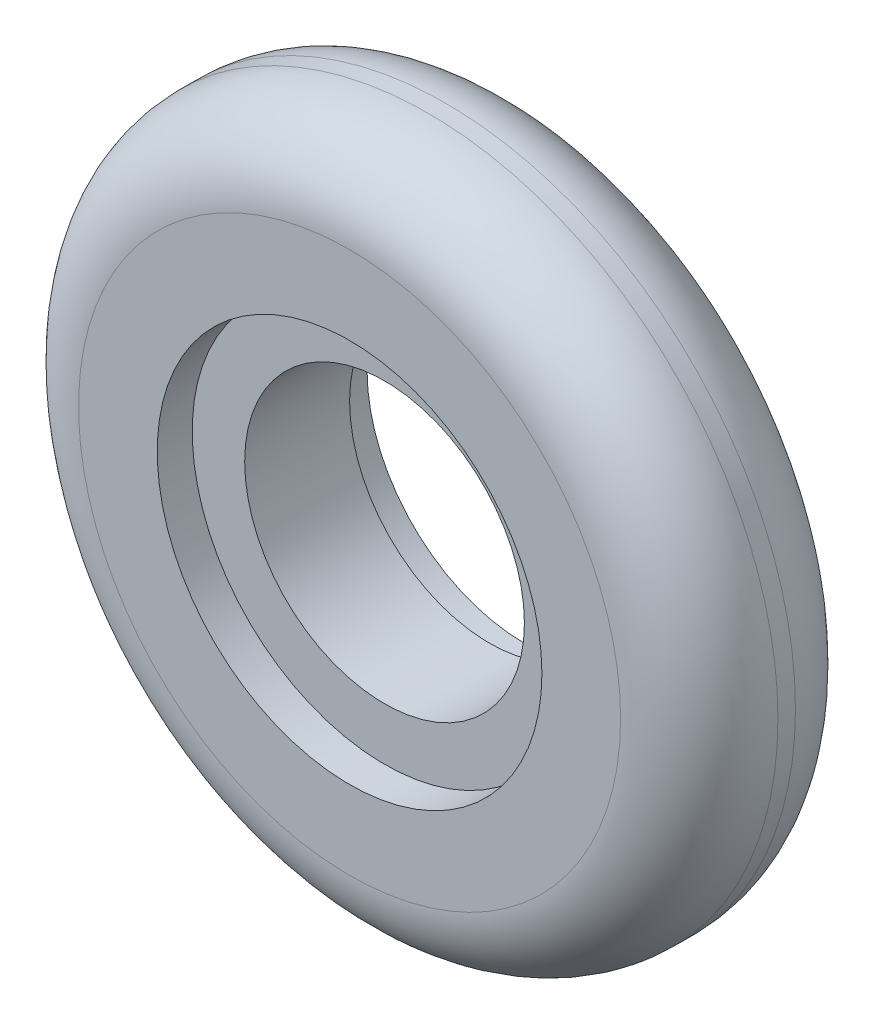
from build123d import *

# Parameters (mm, degrees)
SKETCH1_R           = 20
SKETCH1_R_2         = 8
BOSS_EXTRUDE1_DEPTH = 10
FILLET1_R           = 4.5
SKETCH2_R           = 9
CUT_EXTRUDE1_DEPTH  = 2
SKETCH5_R           = 11
CUT_EXTRUDE2_DEPTH  = 2


with BuildPart() as part:
    # Sketch1 → Boss-Extrude1 (new body)
    with BuildSketch(Plane.XY):
        Circle(SKETCH1_R)
        Circle(SKETCH1_R_2, mode=Mode.SUBTRACT)
    extrude(amount=BOSS_EXTRUDE1_DEPTH)

    # Fillet1
    fillet1_edges = [part.edges().sort_by_distance(p)[0] for p in [
        (-20, 0, 0),
        (-20, 0, 10),
    ]]
    fillet(fillet1_edges, radius=FILLET1_R)

    # Sketch2 → Cut-Extrude1 (cut)
    with BuildSketch(Plane(origin=(0, 0, 0), x_dir=(-1, 0, 0), z_dir=(0, 0, -1))):
        Circle(SKETCH2_R)
    extrude(amount=-CUT_EXTRUDE1_DEPTH, mode=Mode.SUBTRACT)

    # Sketch5 → Cut-Extrude2 (cut)
    with BuildSketch(Plane.XY.offset(10)):
        Circle(SKETCH5_R)
    extrude(amount=-CUT_EXTRUDE2_DEPTH, mode=Mode.SUBTRACT)


solid = part.part
